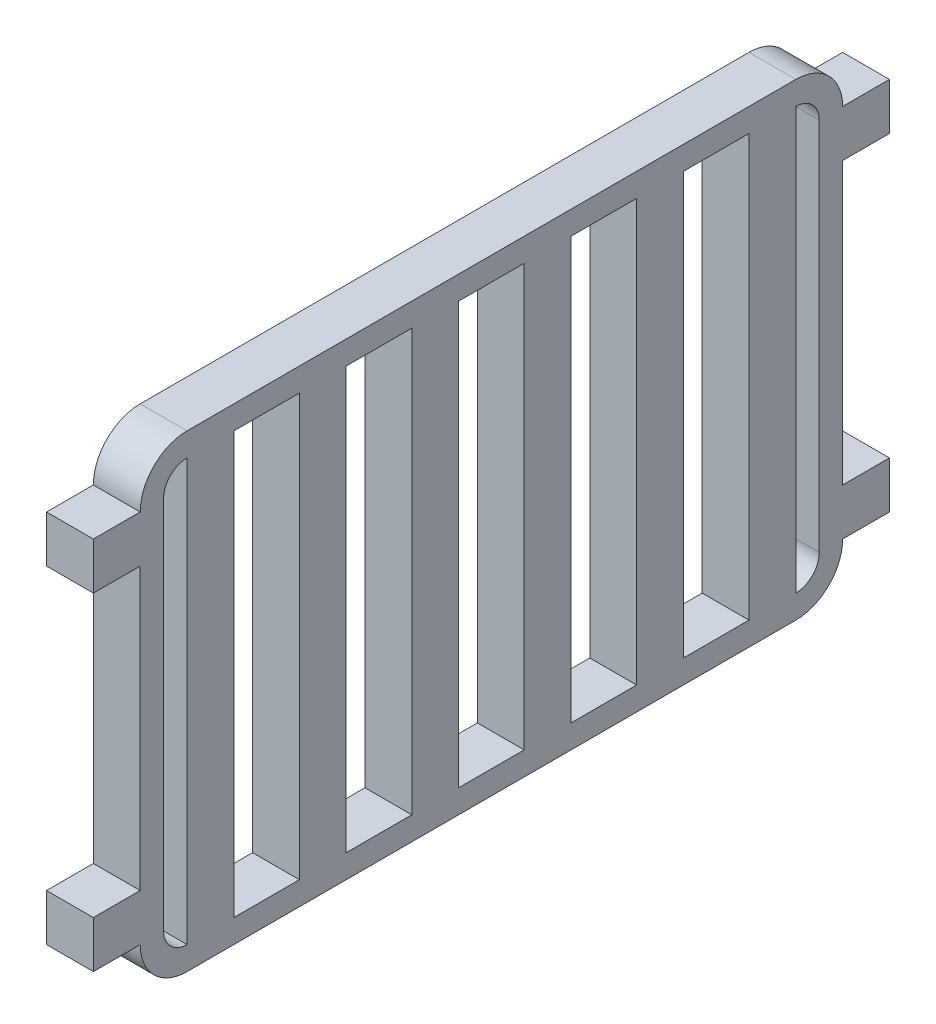
from build123d import *

# Parameters (mm, degrees)
BOSS_EXTRUDE2_DEPTH = 10
CUT_EXTRUDE1_DEPTH  = 10
SKETCH3_W           = 10
SKETCH3_H           = 10
BOSS_EXTRUDE4_DEPTH = 10
SKETCH4_W           = 10
SKETCH4_H           = 10
BOSS_EXTRUDE5_DEPTH = 10
BOSS_EXTRUDE6_REACH = 129.867
SKETCH6_W           = 10
SKETCH6_H           = 10


with BuildPart() as part:
    # Sketch1 → Boss-Extrude2 (new body)
    with BuildSketch(Plane(origin=(0, 0, 0), x_dir=(0, 0, -1), z_dir=(1, 0, 0))):
        with BuildLine():
            Line((-65, 50), (65, 50))
            ThreePointArc((65, 50), (72.071067812, 47.071067812), (75, 40))
            Line((75, 40), (75, -40))
            ThreePointArc((75, -40), (72.071067812, -47.071067812), (65, -50))
            Line((65, -50), (-65, -50))
            ThreePointArc((-65, -50), (-72.071067812, -47.071067812), (-75, -40))
            Line((-75, -40), (-75, 40))
            ThreePointArc((-75, 40), (-72.071067812, 47.071067812), (-65, 50))
        make_face()
    extrude(amount=BOSS_EXTRUDE2_DEPTH)

    # Sketch2 → Cut-Extrude1 (cut)
    with BuildSketch(Plane(origin=(10, 0, 0), x_dir=(0, 0, -1), z_dir=(1, 0, 0))):
        with BuildLine():
            Line((-70, 40), (-70, -40))
            ThreePointArc((-70, -40), (-68.535533906, -43.535533906), (-65, -45))
            Line((-65, -45), (65, -45))
            ThreePointArc((65, -45), (68.535533906, -43.535533906), (70, -40))
            Line((70, -40), (70, 40))
            ThreePointArc((70, 40), (68.535533906, 43.535533906), (65, 45))
            Line((65, 45), (-65, 45))
            ThreePointArc((-65, 45), (-68.535533906, 43.535533906), (-70, 40))
        make_face()
    extrude(amount=-CUT_EXTRUDE1_DEPTH, mode=Mode.SUBTRACT)

    # Sketch3 → Boss-Extrude4 (add)
    with BuildSketch(Plane.XY.offset(75)):
        with Locations((5, 35)):
            Rectangle(SKETCH3_W, SKETCH3_H)
        with Locations((5, -35)):
            Rectangle(SKETCH3_W, SKETCH3_H)
    extrude(amount=BOSS_EXTRUDE4_DEPTH)

    # Sketch4 → Boss-Extrude5 (add)
    with BuildSketch(Plane(origin=(0, 0, -75), x_dir=(-1, 0, 0), z_dir=(0, 0, -1))):
        with Locations((-5, 35)):
            Rectangle(SKETCH4_W, SKETCH4_H)
        with Locations((-5, -35)):
            Rectangle(SKETCH4_W, SKETCH4_H)
    extrude(amount=BOSS_EXTRUDE5_DEPTH)

    # Boss-Extrude6: up to this face of the body (flat: up to its plane)
    boss_extrude6_end = Plane(part.part.faces().sort_by_distance((5, 45, 0))[0])
    # Sketch6 → Boss-Extrude6 (add, up to the picked face)
    with BuildSketch(Plane(origin=(0, -45, 0), x_dir=(1, 0, 0), z_dir=(0, 1, 0)), mode=Mode.PRIVATE) as boss_extrude6_sk1:
        with Locations((5, 60)):
            Rectangle(SKETCH6_W, SKETCH6_H)
    boss_extrude6_tool1 = split(extrude(boss_extrude6_sk1.sketch, amount=BOSS_EXTRUDE6_REACH, mode=Mode.PRIVATE), bisect_by=boss_extrude6_end, keep=Keep.BOTH, mode=Mode.PRIVATE)
    # Sketch6 → Boss-Extrude6 (add, up to the picked face)
    with BuildSketch(Plane(origin=(0, -45, 0), x_dir=(1, 0, 0), z_dir=(0, 1, 0)), mode=Mode.PRIVATE) as boss_extrude6_sk2:
        with Locations((5, 36)):
            Rectangle(SKETCH6_W, SKETCH6_H)
    boss_extrude6_tool2 = split(extrude(boss_extrude6_sk2.sketch, amount=BOSS_EXTRUDE6_REACH, mode=Mode.PRIVATE), bisect_by=boss_extrude6_end, keep=Keep.BOTH, mode=Mode.PRIVATE)
    # Sketch6 → Boss-Extrude6 (add, up to the picked face)
    with BuildSketch(Plane(origin=(0, -45, 0), x_dir=(1, 0, 0), z_dir=(0, 1, 0)), mode=Mode.PRIVATE) as boss_extrude6_sk3:
        with Locations((5, 12)):
            Rectangle(SKETCH6_W, SKETCH6_H)
    boss_extrude6_tool3 = split(extrude(boss_extrude6_sk3.sketch, amount=BOSS_EXTRUDE6_REACH, mode=Mode.PRIVATE), bisect_by=boss_extrude6_end, keep=Keep.BOTH, mode=Mode.PRIVATE)
    # Sketch6 → Boss-Extrude6 (add, up to the picked face)
    with BuildSketch(Plane(origin=(0, -45, 0), x_dir=(1, 0, 0), z_dir=(0, 1, 0)), mode=Mode.PRIVATE) as boss_extrude6_sk4:
        with Locations((5, -12)):
            Rectangle(SKETCH6_W, SKETCH6_H)
    boss_extrude6_tool4 = split(extrude(boss_extrude6_sk4.sketch, amount=BOSS_EXTRUDE6_REACH, mode=Mode.PRIVATE), bisect_by=boss_extrude6_end, keep=Keep.BOTH, mode=Mode.PRIVATE)
    # Sketch6 → Boss-Extrude6 (add, up to the picked face)
    with BuildSketch(Plane(origin=(0, -45, 0), x_dir=(1, 0, 0), z_dir=(0, 1, 0)), mode=Mode.PRIVATE) as boss_extrude6_sk5:
        with Locations((5, -60)):
            Rectangle(SKETCH6_W, SKETCH6_H)
    boss_extrude6_tool5 = split(extrude(boss_extrude6_sk5.sketch, amount=BOSS_EXTRUDE6_REACH, mode=Mode.PRIVATE), bisect_by=boss_extrude6_end, keep=Keep.BOTH, mode=Mode.PRIVATE)
    # Sketch6 → Boss-Extrude6 (add, up to the picked face)
    with BuildSketch(Plane(origin=(0, -45, 0), x_dir=(1, 0, 0), z_dir=(0, 1, 0)), mode=Mode.PRIVATE) as boss_extrude6_sk6:
        with Locations((5, -36)):
            Rectangle(SKETCH6_W, SKETCH6_H)
    boss_extrude6_tool6 = split(extrude(boss_extrude6_sk6.sketch, amount=BOSS_EXTRUDE6_REACH, mode=Mode.PRIVATE), bisect_by=boss_extrude6_end, keep=Keep.BOTH, mode=Mode.PRIVATE)
    add(boss_extrude6_tool1.solids().sort_by(Axis((5, -45, -60), (0, 1, 0)))[0])
    add(boss_extrude6_tool2.solids().sort_by(Axis((5, -45, -36), (0, 1, 0)))[0])
    add(boss_extrude6_tool3.solids().sort_by(Axis((5, -45, -12), (0, 1, 0)))[0])
    add(boss_extrude6_tool4.solids().sort_by(Axis((5, -45, 12), (0, 1, 0)))[0])
    add(boss_extrude6_tool5.solids().sort_by(Axis((5, -45, 60), (0, 1, 0)))[0])
    add(boss_extrude6_tool6.solids().sort_by(Axis((5, -45, 36), (0, 1, 0)))[0])


solid = part.part
